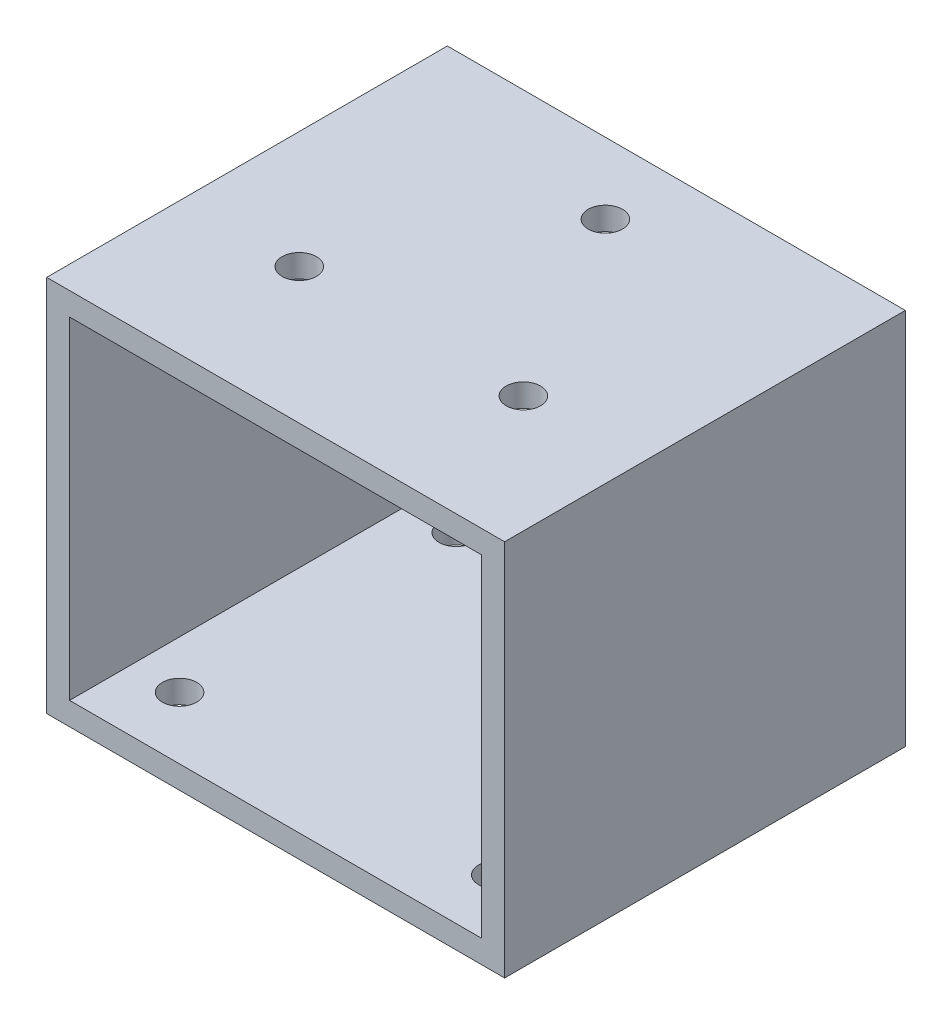
from build123d import *

# Parameters (mm, degrees)
SKETCH1_W           = 40
SKETCH1_H           = 33
SKETCH1_W_2         = 36
SKETCH1_H_2         = 29
BOSS_EXTRUDE1_DEPTH = 35
SKETCH2_R           = 1.5
CUT_EXTRUDE1_DEPTH  = 15
SKETCH3_R           = 1.5
CUT_EXTRUDE2_DEPTH  = 15


with BuildPart() as part:
    # Sketch1 → Boss-Extrude1 (new body)
    with BuildSketch(Plane.XY):
        Rectangle(SKETCH1_W, SKETCH1_H)
        Rectangle(SKETCH1_W_2, SKETCH1_H_2, mode=Mode.SUBTRACT)
    extrude(amount=BOSS_EXTRUDE1_DEPTH)

    # Sketch2 → Cut-Extrude1 (cut)
    with BuildSketch(Plane(origin=(0, 16.5, 0), x_dir=(1, 0, 0), z_dir=(0, 1, 0))):
        with Locations(Location((0, -6.2, 0), (0, 0, 180))):
            Circle(SKETCH2_R)
        with Locations(Location((9.786087063, -23.15, 0), (0, 0, 180))):
            Circle(SKETCH2_R)
        with Locations(Location((-9.786087063, -23.15, 0), (0, 0, 180))):
            Circle(SKETCH2_R)
    extrude(amount=-CUT_EXTRUDE1_DEPTH, mode=Mode.SUBTRACT)

    # Sketch3 → Cut-Extrude2 (cut)
    with BuildSketch(Plane.XZ.offset(16.5)):
        with Locations((13.809468579, 29.583285006)):
            Circle(SKETCH3_R)
        with Locations((-13.809468579, 29.583285006)):
            Circle(SKETCH3_R)
        with Locations(Location((13.809468579, 5.416714994, 0), (0, 0, 180))):
            Circle(SKETCH3_R)
        with Locations(Location((-13.809468579, 5.416714994, 0), (0, 0, 180))):
            Circle(SKETCH3_R)
    extrude(amount=-CUT_EXTRUDE2_DEPTH, mode=Mode.SUBTRACT)


solid = part.part
